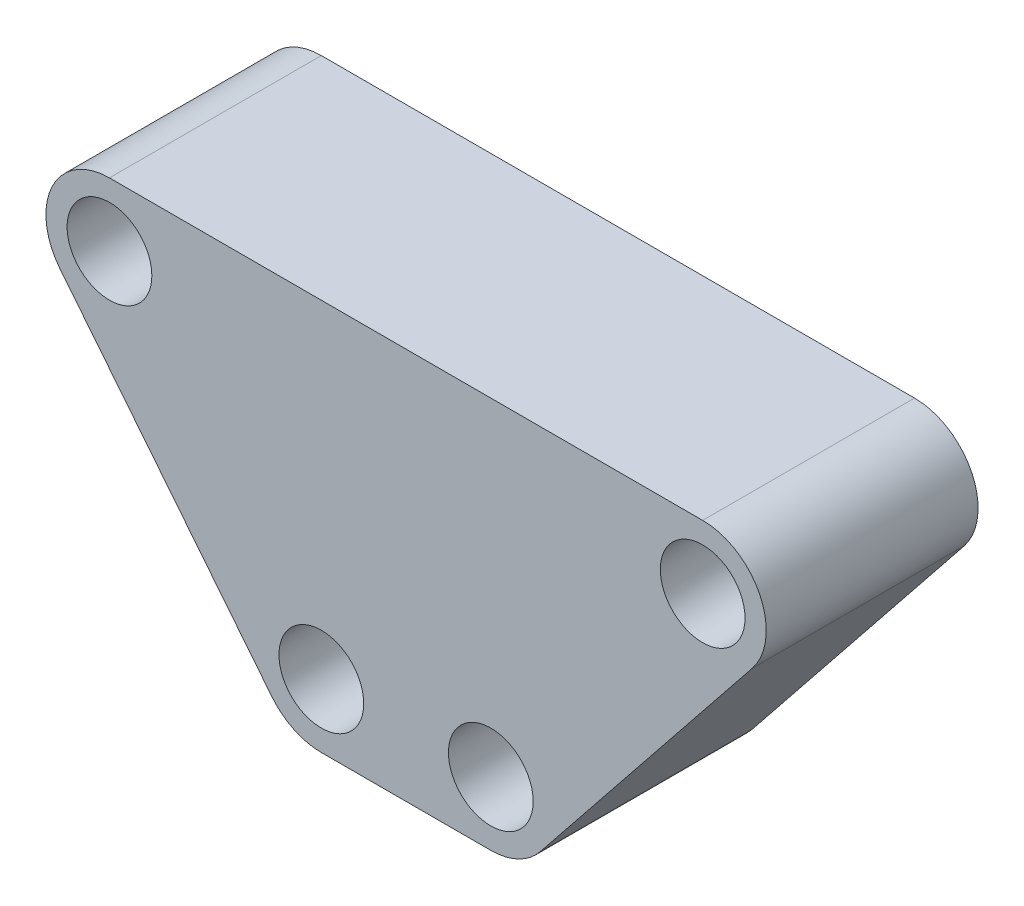
from build123d import *

# Parameters (mm, degrees)
EXTRUDE_1_DEPTH     = 25
SKETCH_2_R          = 5
CUT_EXTRUDE_1_DEPTH = 10


with BuildPart() as part:
    # 草图1 → 凸台-拉伸1 (new body)
    with BuildSketch(Plane.XY):
        with BuildLine():
            Line((0, -7.5), (20, -7.5))
            ThreePointArc((20, -7.5), (23.247595264, -6.760408641), (25.854685623, -4.6875))
            Line((25.854685623, -4.6875), (50.854685623, 26.537489992))
            ThreePointArc((50.854685623, 26.537489992), (51.760408641, 34.472585256), (45, 38.724989992))
            Line((45, 38.724989992), (-25, 38.724989992))
            ThreePointArc((-25, 38.724989992), (-31.760408641, 34.472585256), (-30.854685623, 26.537489992))
            Line((-30.854685623, 26.537489992), (-5.854685623, -4.6875))
            ThreePointArc((-5.854685623, -4.6875), (-3.247595264, -6.760408641), (0, -7.5))
        make_face()
    extrude(amount=EXTRUDE_1_DEPTH)

    # 草图2 → 切除-拉伸1 (cut)
    with BuildSketch(Plane.XY.offset(25)):
        with Locations((-25, 31.224989992)):
            Circle(SKETCH_2_R)
        Circle(SKETCH_2_R)
        with Locations((20, 0)):
            Circle(SKETCH_2_R)
        with Locations((45, 31.224989992)):
            Circle(SKETCH_2_R)
    extrude(amount=-CUT_EXTRUDE_1_DEPTH, mode=Mode.SUBTRACT)


solid = part.part
